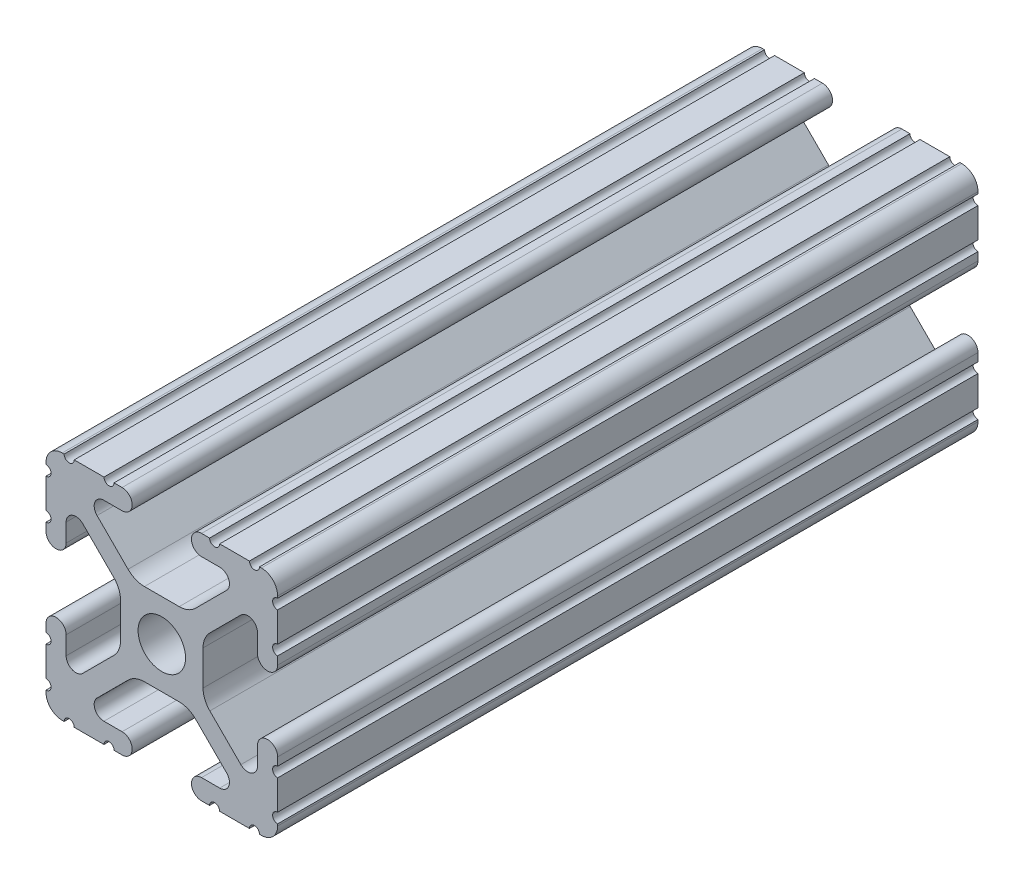
from build123d import *

# Parameters (mm, degrees)
SKETCH3_W           = 25.4
SKETCH3_H           = 25.4
BOSS_EXTRUDE1_DEPTH = 76.8
SKETCH4_R           = 2.6035
CUT_EXTRUDE1_DEPTH  = 79.872175068
CUT_EXTRUDE2_DEPTH  = 79.872175068
FILLET1_R           = 2.54
FILLET2_R           = 1.778


with BuildPart() as part:
    # Sketch3 → Boss-Extrude1 (new body)
    with BuildSketch(Plane.XY):
        Rectangle(SKETCH3_W, SKETCH3_H)
    extrude(amount=BOSS_EXTRUDE1_DEPTH)

    # Sketch4 → Cut-Extrude1 (cut, through all)
    with BuildSketch(Plane.XY.offset(76.8)):
        with BuildLine():
            Line((3.2512, 12.7), (-3.2512, 12.7))
            Line((-3.2512, 12.7), (-3.2512, 10.4902))
            Line((-3.2512, 10.4902), (-6.348478019, 10.4902))
            ThreePointArc((-6.348478019, 10.4902), (-7.335478831, 9.830707141), (-7.103895736, 8.666460301))
            Line((-7.103895736, 8.666460301), (-2.958635435, 4.5212))
            Line((-2.958635435, 4.5212), (2.958635435, 4.5212))
            Line((2.958635435, 4.5212), (7.103895736, 8.666460301))
            ThreePointArc((7.103895736, 8.666460301), (7.335478831, 9.830707141), (6.348478019, 10.4902))
            Line((6.348478019, 10.4902), (3.2512, 10.4902))
            Line((3.2512, 10.4902), (3.2512, 12.7))
        make_face()
        with BuildLine():
            Line((12.7, -3.2512), (12.7, 3.2512))
            Line((12.7, 3.2512), (10.4902, 3.2512))
            Line((10.4902, 3.2512), (10.4902, 6.348478019))
            ThreePointArc((10.4902, 6.348478019), (9.830707141, 7.335478831), (8.666460301, 7.103895736))
            Line((8.666460301, 7.103895736), (4.5212, 2.958635435))
            Line((4.5212, 2.958635435), (4.5212, -2.958635435))
            Line((4.5212, -2.958635435), (8.666460301, -7.103895736))
            ThreePointArc((8.666460301, -7.103895736), (9.830707141, -7.335478831), (10.4902, -6.348478019))
            Line((10.4902, -6.348478019), (10.4902, -3.2512))
            Line((10.4902, -3.2512), (12.7, -3.2512))
        make_face()
        with BuildLine():
            Line((-3.2512, -10.4902), (-3.2512, -12.7))
            Line((-3.2512, -12.7), (3.2512, -12.7))
            Line((3.2512, -12.7), (3.2512, -10.4902))
            Line((3.2512, -10.4902), (6.348478019, -10.4902))
            ThreePointArc((6.348478019, -10.4902), (7.335478831, -9.830707141), (7.103895736, -8.666460301))
            Line((7.103895736, -8.666460301), (2.958635435, -4.5212))
            Line((2.958635435, -4.5212), (-2.958635435, -4.5212))
            Line((-2.958635435, -4.5212), (-7.103895736, -8.666460301))
            ThreePointArc((-7.103895736, -8.666460301), (-7.335478831, -9.830707141), (-6.348478019, -10.4902))
            Line((-6.348478019, -10.4902), (-3.2512, -10.4902))
        make_face()
        with BuildLine():
            Line((-10.4902, 3.2512), (-12.7, 3.2512))
            Line((-12.7, 3.2512), (-12.7, -3.2512))
            Line((-12.7, -3.2512), (-10.4902, -3.2512))
            Line((-10.4902, -3.2512), (-10.4902, -6.348478019))
            ThreePointArc((-10.4902, -6.348478019), (-9.830707141, -7.335478831), (-8.666460301, -7.103895736))
            Line((-8.666460301, -7.103895736), (-4.5212, -2.958635435))
            Line((-4.5212, -2.958635435), (-4.5212, 2.958635435))
            Line((-4.5212, 2.958635435), (-8.666460301, 7.103895736))
            ThreePointArc((-8.666460301, 7.103895736), (-9.830707141, 7.335478831), (-10.4902, 6.348478019))
            Line((-10.4902, 6.348478019), (-10.4902, 3.2512))
        make_face()
        Circle(SKETCH4_R)
    extrude(amount=-CUT_EXTRUDE1_DEPTH, mode=Mode.SUBTRACT)

    # Sketch5 → Cut-Extrude2 (cut, through all)
    with BuildSketch(Plane.XY.offset(76.8)):
        with BuildLine():
            ThreePointArc((-11.5951, 3.2512), (-12.376382283, 3.574817717), (-12.7, 4.3561))
            Line((-12.7, 4.3561), (-12.7, 3.2512))
            Line((-12.7, 3.2512), (-11.5951, 3.2512))
        make_face()
        with BuildLine():
            ThreePointArc((-10.4902, 4.3561), (-10.813817717, 3.574817717), (-11.5951, 3.2512))
            Line((-11.5951, 3.2512), (-10.4902, 3.2512))
            Line((-10.4902, 3.2512), (-10.4902, 4.3561))
        make_face()
        with BuildLine():
            Line((-12.7, -3.2512), (-12.7, -4.3561))
            ThreePointArc((-12.7, -4.3561), (-12.376382283, -3.574817717), (-11.5951, -3.2512))
            Line((-11.5951, -3.2512), (-12.7, -3.2512))
        make_face()
        with BuildLine():
            Line((-10.4902, -3.2512), (-11.5951, -3.2512))
            ThreePointArc((-11.5951, -3.2512), (-10.813817717, -3.574817717), (-10.4902, -4.3561))
            Line((-10.4902, -4.3561), (-10.4902, -3.2512))
        make_face()
        with BuildLine():
            Line((-3.2512, -11.595100007), (-3.2512, -10.4902))
            Line((-3.2512, -10.4902), (-4.3561, -10.4902))
            ThreePointArc((-4.3561, -10.4902), (-3.574817715, -10.81381772), (-3.2512, -11.595100007))
        make_face()
        with BuildLine():
            Line((-3.2512, -12.7), (-3.2512, -11.595100007))
            ThreePointArc((-3.2512, -11.595100007), (-3.57481772, -12.376382285), (-4.3561, -12.7))
            Line((-4.3561, -12.7), (-3.2512, -12.7))
        make_face()
        with BuildLine():
            Line((3.2512, -10.4902), (3.2512, -11.5951))
            ThreePointArc((3.2512, -11.5951), (3.574817718, -10.813817717), (4.3561, -10.4902))
            Line((4.3561, -10.4902), (3.2512, -10.4902))
        make_face()
        with BuildLine():
            Line((3.2512, -12.7), (4.3561, -12.7))
            ThreePointArc((4.3561, -12.7), (3.574817717, -12.376382282), (3.2512, -11.5951))
            Line((3.2512, -11.5951), (3.2512, -12.7))
        make_face()
        with BuildLine():
            Line((11.5951, -3.2512), (10.4902, -3.2512))
            Line((10.4902, -3.2512), (10.4902, -4.3561))
            ThreePointArc((10.4902, -4.3561), (10.813817717, -3.574817717), (11.5951, -3.2512))
        make_face()
        with BuildLine():
            Line((12.7, -3.2512), (11.5951, -3.2512))
            ThreePointArc((11.5951, -3.2512), (12.376382283, -3.574817717), (12.7, -4.3561))
            Line((12.7, -4.3561), (12.7, -3.2512))
        make_face()
        with BuildLine():
            Line((10.4902, 3.2512), (11.5951, 3.2512))
            ThreePointArc((11.5951, 3.2512), (10.813817717, 3.574817717), (10.4902, 4.3561))
            Line((10.4902, 4.3561), (10.4902, 3.2512))
        make_face()
        with BuildLine():
            Line((12.7, 3.2512), (12.7, 4.3561))
            ThreePointArc((12.7, 4.3561), (12.376382283, 3.574817717), (11.5951, 3.2512))
            Line((11.5951, 3.2512), (12.7, 3.2512))
        make_face()
        with BuildLine():
            Line((3.2512, 12.7), (3.2512, 11.595099996))
            ThreePointArc((3.2512, 11.595099996), (3.574817716, 12.376382281), (4.3561, 12.7))
            Line((4.3561, 12.7), (3.2512, 12.7))
        make_face()
        with BuildLine():
            Line((3.2512, 11.595099996), (3.2512, 10.4902))
            Line((3.2512, 10.4902), (4.3561, 10.4902))
            ThreePointArc((4.3561, 10.4902), (3.574817719, 10.813817716), (3.2512, 11.595099996))
        make_face()
        with BuildLine():
            Line((-3.2512, 12.7), (-4.3561, 12.7))
            ThreePointArc((-4.3561, 12.7), (-3.574817717, 12.376382283), (-3.2512, 11.5951))
            Line((-3.2512, 11.5951), (-3.2512, 12.7))
        make_face()
        with BuildLine():
            Line((-3.2512, 10.4902), (-3.2512, 11.5951))
            ThreePointArc((-3.2512, 11.5951), (-3.574817717, 10.813817717), (-4.3561, 10.4902))
            Line((-4.3561, 10.4902), (-3.2512, 10.4902))
        make_face()
        with BuildLine():
            ThreePointArc((-12.7, 5.23875), (-12.14755, 5.7912), (-12.7, 6.34365))
            Line((-12.7, 6.34365), (-12.7, 5.23875))
        make_face()
        with BuildLine():
            ThreePointArc((-12.7, 9.60755), (-12.14755, 10.16), (-12.7, 10.71245))
            Line((-12.7, 10.71245), (-12.7, 9.60755))
        make_face()
        with BuildLine():
            ThreePointArc((-10.71245, 12.7), (-10.16, 12.14755), (-9.60755, 12.7))
            Line((-9.60755, 12.7), (-10.71245, 12.7))
        make_face()
        with BuildLine():
            ThreePointArc((-6.34365, 12.7), (-5.7912, 12.14755), (-5.23875, 12.7))
            Line((-5.23875, 12.7), (-6.34365, 12.7))
        make_face()
        with BuildLine():
            Line((6.34365, 12.7), (5.23875, 12.7))
            ThreePointArc((5.23875, 12.7), (5.7912, 12.14755), (6.34365, 12.7))
        make_face()
        with BuildLine():
            Line((10.71245, 12.7), (9.60755, 12.7))
            ThreePointArc((9.60755, 12.7), (10.16, 12.14755), (10.71245, 12.7))
        make_face()
        with BuildLine():
            Line((12.7, 10.71245), (12.7, 9.60755))
            ThreePointArc((12.7, 9.60755), (12.14755, 10.16), (12.7, 10.71245))
        make_face()
        with BuildLine():
            Line((12.7, 6.34365), (12.7, 5.23875))
            ThreePointArc((12.7, 5.23875), (12.14755, 5.7912), (12.7, 6.34365))
        make_face()
        with BuildLine():
            Line((-12.7, -6.34365), (-12.7, -5.23875))
            ThreePointArc((-12.7, -5.23875), (-12.14755, -5.7912), (-12.7, -6.34365))
        make_face()
        with BuildLine():
            Line((-12.7, -10.71245), (-12.7, -9.60755))
            ThreePointArc((-12.7, -9.60755), (-12.14755, -10.16), (-12.7, -10.71245))
        make_face()
        with BuildLine():
            Line((-10.71245, -12.7), (-9.60755, -12.7))
            ThreePointArc((-9.60755, -12.7), (-10.16, -12.14755), (-10.71245, -12.7))
        make_face()
        with BuildLine():
            Line((-6.34365, -12.7), (-5.23875, -12.7))
            ThreePointArc((-5.23875, -12.7), (-5.7912, -12.14755), (-6.34365, -12.7))
        make_face()
        with BuildLine():
            Line((12.7, -10.71245), (12.7, -9.60755))
            ThreePointArc((12.7, -9.60755), (12.14755, -10.16), (12.7, -10.71245))
        make_face()
        with BuildLine():
            Line((12.7, -6.34365), (12.7, -5.23875))
            ThreePointArc((12.7, -5.23875), (12.14755, -5.7912), (12.7, -6.34365))
        make_face()
        with BuildLine():
            Line((10.71245, -12.7), (9.60755, -12.7))
            ThreePointArc((9.60755, -12.7), (10.16, -12.14755), (10.71245, -12.7))
        make_face()
        with BuildLine():
            Line((6.34365, -12.7), (5.23875, -12.7))
            ThreePointArc((5.23875, -12.7), (5.7912, -12.14755), (6.34365, -12.7))
        make_face()
    extrude(amount=-CUT_EXTRUDE2_DEPTH, mode=Mode.SUBTRACT)

    # Fillet1
    fillet1_edges = [part.edges().sort_by_distance(p)[0] for p in [
        (-2.958635435, -4.5212, 38.4),
        (2.958635435, -4.5212, 38.4),
        (4.5212, -2.958635435, 38.4),
        (4.5212, 2.958635435, 38.4),
        (-4.5212, 2.958635435, 38.4),
        (-4.5212, -2.958635435, 38.4),
        (2.958635435, 4.5212, 38.4),
        (-2.958635435, 4.5212, 38.4),
    ]]
    fillet(fillet1_edges, radius=FILLET1_R)

    # Fillet2
    fillet2_edges = [part.edges().sort_by_distance(p)[0] for p in [
        (-12.7, 12.7, 38.4),
        (12.7, 12.7, 38.4),
        (12.7, -12.7, 38.4),
        (-12.7, -12.7, 38.4),
    ]]
    fillet(fillet2_edges, radius=FILLET2_R)


solid = part.part
